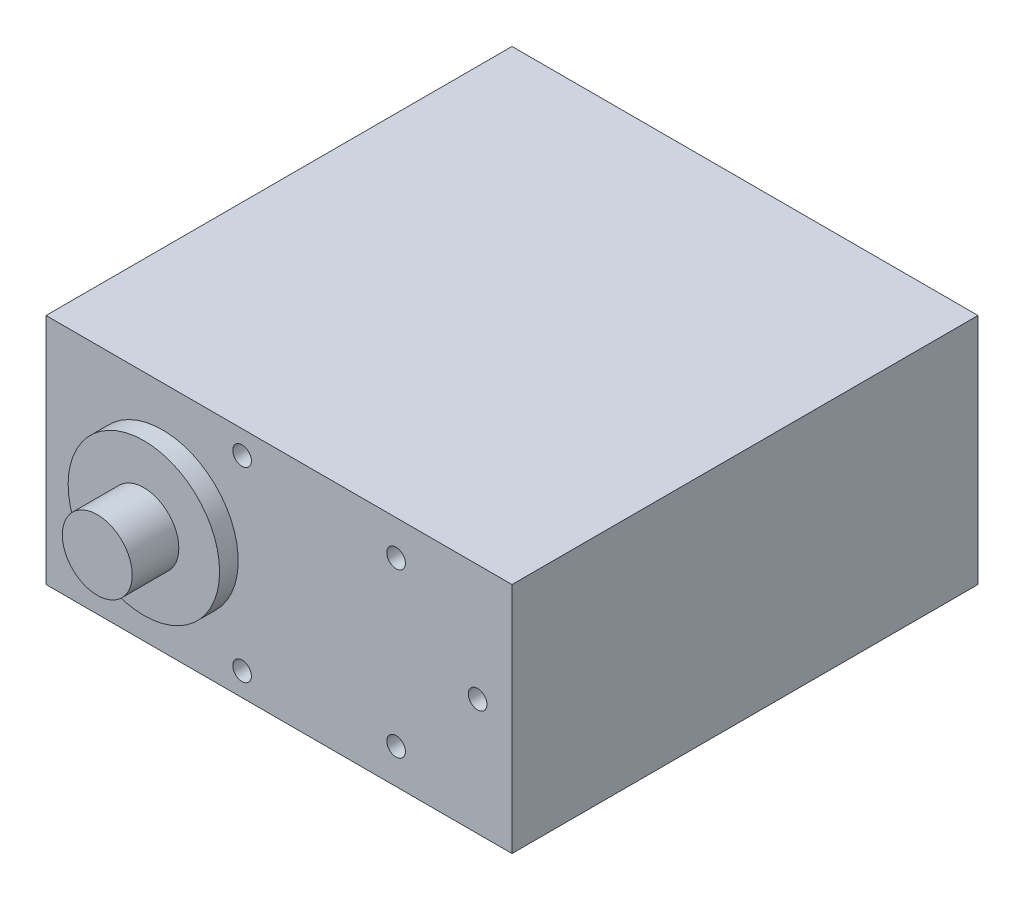
from build123d import *

# Parameters (mm, degrees)
SKETCH1_W              = 40
SKETCH1_H              = 40
BODY_DEPTH             = 20
SKETCH2_R              = 0.8
ROTORSIDE_HOLES_DEPTH  = 10
SKETCH3_R              = 0.8
SLIDERSIDE_HOLES_DEPTH = 10
SKETCH4_R              = 6.5
ROTOREXTEND_DEPTH      = 1.6
SKETCH5_R              = 3
ROTOR_DEPTH            = 4
SLIDEREXTEND_START     = 1.6
SKETCH6_R              = 6.5
SLIDEREXTEND_DEPTH     = 1.6
SLIDER_START           = 4
SKETCH7_R              = 3
SLIDER_DEPTH           = 4


with BuildPart() as part:
    # Sketch1 → Body (new body)
    with BuildSketch(Plane(origin=(0, 0, 0), x_dir=(1, 0, 0), z_dir=(0, 1, 0))):
        with Locations((20, 20)):
            Rectangle(SKETCH1_W, SKETCH1_H)
    extrude(amount=BODY_DEPTH)

    # Sketch2 → RotorSide-Holes (cut)
    with BuildSketch(Plane(origin=(0, 20, 0), x_dir=(1, 0, 0), z_dir=(0, 0, -1))):
        with Locations((30.05, 3)):
            Circle(SKETCH2_R)
        with Locations((37.05, 10)):
            Circle(SKETCH2_R)
        with Locations((30.05, 17)):
            Circle(SKETCH2_R)
        with Locations((16.83, 2)):
            Circle(SKETCH2_R)
        with Locations((16.83, 18)):
            Circle(SKETCH2_R)
    extrude(amount=ROTORSIDE_HOLES_DEPTH, mode=Mode.SUBTRACT)

    # Sketch3 → SliderSide-Holes (cut)
    with BuildSketch(Plane(origin=(0, 0, -40), x_dir=(-1, 0, 0), z_dir=(0, 0, -1))):
        with Locations((-37.5, 17.5)):
            Circle(SKETCH3_R)
        with Locations((-37.5, 2.5)):
            Circle(SKETCH3_R)
        with Locations((-22.5, 17.5)):
            Circle(SKETCH3_R)
        with Locations((-22.5, 2.5)):
            Circle(SKETCH3_R)
        with Locations((-2.5, 17.5)):
            Circle(SKETCH3_R)
        with Locations((-2.5, 2.5)):
            Circle(SKETCH3_R)
    extrude(amount=-SLIDERSIDE_HOLES_DEPTH, mode=Mode.SUBTRACT)

    # Sketch4 → RotorExtend (add)
    with BuildSketch(Plane.XY):
        with Locations((10, 10)):
            Circle(SKETCH4_R)
    extrude(amount=ROTOREXTEND_DEPTH)

    # Sketch5 → Rotor (add)
    with BuildSketch(Plane.XY.offset(1.6)):
        with Locations((10, 10)):
            Circle(SKETCH5_R)
    extrude(amount=ROTOR_DEPTH)

    # Sketch6 → SliderExtend (add)
    with BuildSketch(Plane(origin=(0, 0, -40), x_dir=(-1, 0, 0), z_dir=(0, 0, -1)).offset(SLIDEREXTEND_START)):
        with Locations((-10, 10)):
            Circle(SKETCH6_R)
    extrude(amount=-SLIDEREXTEND_DEPTH)

    # Sketch7 → Slider (add)
    with BuildSketch(Plane(origin=(0, 0, -41.6), x_dir=(-1, 0, 0), z_dir=(0, 0, -1)).offset(SLIDER_START)):
        with Locations((-10, 10)):
            Circle(SKETCH7_R)
    extrude(amount=-SLIDER_DEPTH)


solid = part.part
